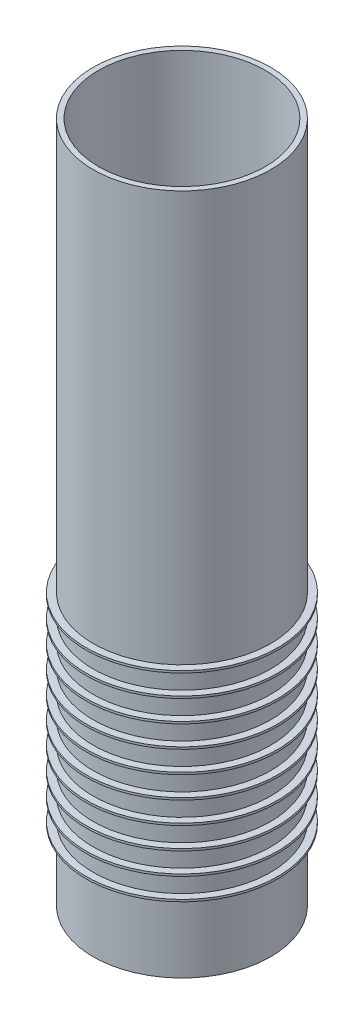
from build123d import *

# Parameters (mm, degrees)
SKETCH1_R           = 31.75
BOSS_EXTRUDE1_DEPTH = 243.84
SKETCH2_R           = 34.29
BOSS_EXTRUDE2_DEPTH = 0.762
LPATTERN1_COUNT     = 10
LPATTERN1_PITCH     = 7.874
SKETCH3_R           = 29.845
CUT_EXTRUDE1_DEPTH  = 249.61527266


with BuildPart() as part:
    # Sketch1 → Boss-Extrude1 (new body)
    with BuildSketch(Plane(origin=(0, 0, 0), x_dir=(1, 0, 0), z_dir=(0, 1, 0))):
        with Locations(Location((0, 0, 0), (0, 0, 90))):
            Circle(SKETCH1_R)
    extrude(amount=BOSS_EXTRUDE1_DEPTH)

    # Sketch2 → Boss-Extrude2 (add)
    with BuildSketch(Plane(origin=(0, 25.4, 0), x_dir=(1, 0, 0), z_dir=(0, 1, 0))):
        with Locations(Location((0, 0, 0), (0, 0, 90))):
            Circle(SKETCH2_R)
    boss_extrude2 = extrude(amount=BOSS_EXTRUDE2_DEPTH)

    # LPattern1: Boss-Extrude2 ×10
    with Locations(*[(0, i * LPATTERN1_PITCH, 0) for i in range(1, LPATTERN1_COUNT)]):
        add(boss_extrude2)

    # Sketch3 → Cut-Extrude1 (cut, through all)
    with BuildSketch(Plane(origin=(0, 243.84, 0), x_dir=(1, 0, 0), z_dir=(0, 1, 0))):
        with Locations(Location((0, 0, 0), (0, 0, 270))):
            Circle(SKETCH3_R)
    extrude(amount=-CUT_EXTRUDE1_DEPTH, mode=Mode.SUBTRACT)


solid = part.part
